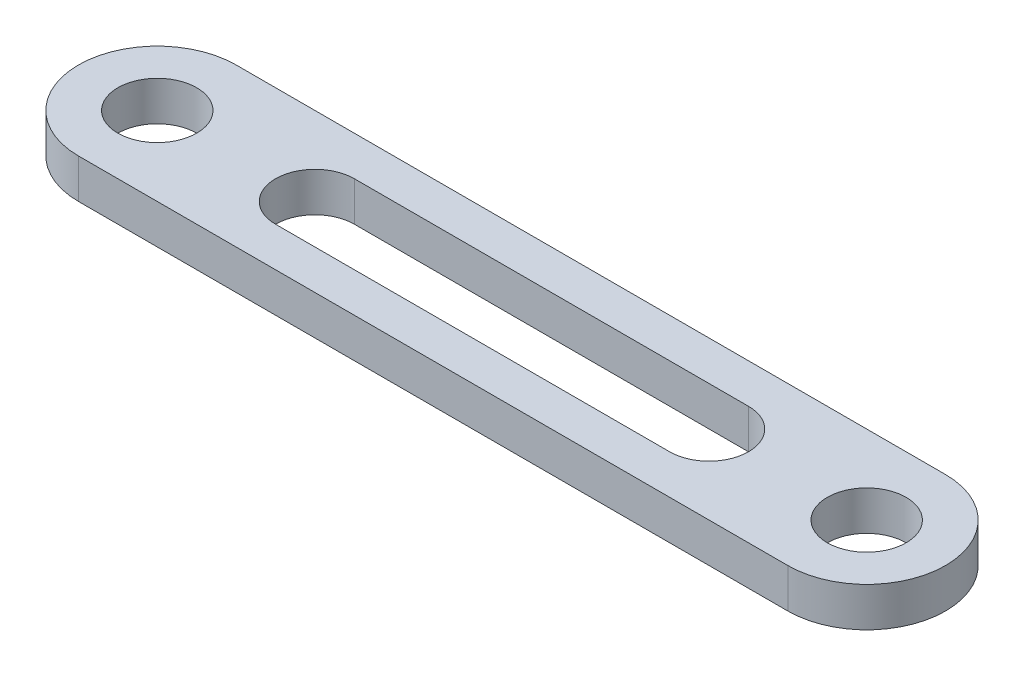
from build123d import *

# Parameters (mm, degrees)
BOSS_EXTRUDE1_DEPTH = 5
CUT_EXTRUDE1_DEPTH  = 57.124860802
SKETCH3_R           = 5
CUT_EXTRUDE2_DEPTH  = 57.124860802
SKETCH4_R           = 5
CUT_EXTRUDE3_DEPTH  = 57.124860802


with BuildPart() as part:
    # Sketch1 → Boss-Extrude1 (new body)
    with BuildSketch(Plane(origin=(0, 0, 0), x_dir=(1, 0, 0), z_dir=(0, 1, 0))):
        with BuildLine():
            Line((-45, 10), (45, 10))
            ThreePointArc((45, 10), (55, 0), (45, -10))
            Line((45, -10), (-45, -10))
            ThreePointArc((-45, -10), (-55, 0), (-45, 10))
        make_face()
    extrude(amount=BOSS_EXTRUDE1_DEPTH)

    # Sketch2 → Cut-Extrude1 (cut, through all)
    with BuildSketch(Plane(origin=(0, 5, 0), x_dir=(1, 0, 0), z_dir=(0, 1, 0))):
        with BuildLine():
            Line((-25, 5), (25, 5))
            ThreePointArc((25, 5), (30, 0), (25, -5))
            Line((25, -5), (-25, -5))
            ThreePointArc((-25, -5), (-30, 0), (-25, 5))
        make_face()
    extrude(amount=-CUT_EXTRUDE1_DEPTH, mode=Mode.SUBTRACT)

    # Sketch3 → Cut-Extrude2 (cut, through all)
    with BuildSketch(Plane(origin=(0, 5, 0), x_dir=(1, 0, 0), z_dir=(0, 1, 0))):
        with Locations(Location((45, 0, 0), (0, 0, 270))):
            Circle(SKETCH3_R)
    extrude(amount=-CUT_EXTRUDE2_DEPTH, mode=Mode.SUBTRACT)

    # Sketch4 → Cut-Extrude3 (cut, through all)
    with BuildSketch(Plane(origin=(0, 5, 0), x_dir=(1, 0, 0), z_dir=(0, 1, 0))):
        with Locations(Location((-45, 0, 0), (0, 0, 270))):
            Circle(SKETCH4_R)
    extrude(amount=-CUT_EXTRUDE3_DEPTH, mode=Mode.SUBTRACT)


solid = part.part
